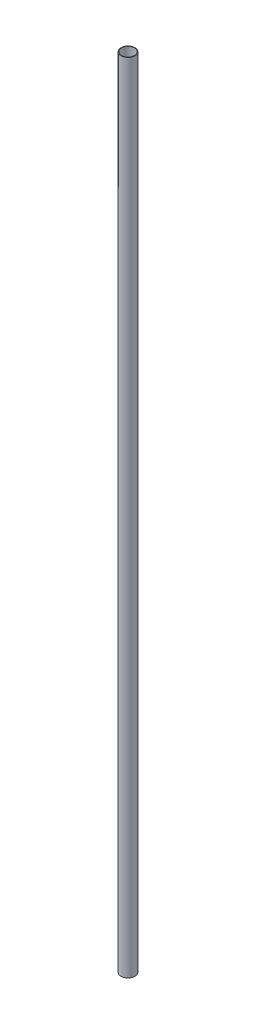
from build123d import *

# Parameters (mm, degrees)
SKETCH1_R           = 7.5
BOSS_EXTRUDE1_DEPTH = 857
SKETCH2_R           = 7
CUT_EXTRUDE1_DEPTH  = 858.065633426


with BuildPart() as part:
    # Sketch1 → Boss-Extrude1 (new body)
    with BuildSketch(Plane(origin=(0, 0, 0), x_dir=(1, 0, 0), z_dir=(0, 1, 0))):
        with Locations(Location((0, 0, 0), (0, 0, 270))):
            Circle(SKETCH1_R)
    extrude(amount=-BOSS_EXTRUDE1_DEPTH)

    # Sketch2 → Cut-Extrude1 (cut, through all)
    with BuildSketch(Plane(origin=(0, 0, 0), x_dir=(1, 0, 0), z_dir=(0, 1, 0))):
        with Locations(Location((0, 0, 0), (0, 0, 270))):
            Circle(SKETCH2_R)
    extrude(amount=-CUT_EXTRUDE1_DEPTH, mode=Mode.SUBTRACT)


solid = part.part
